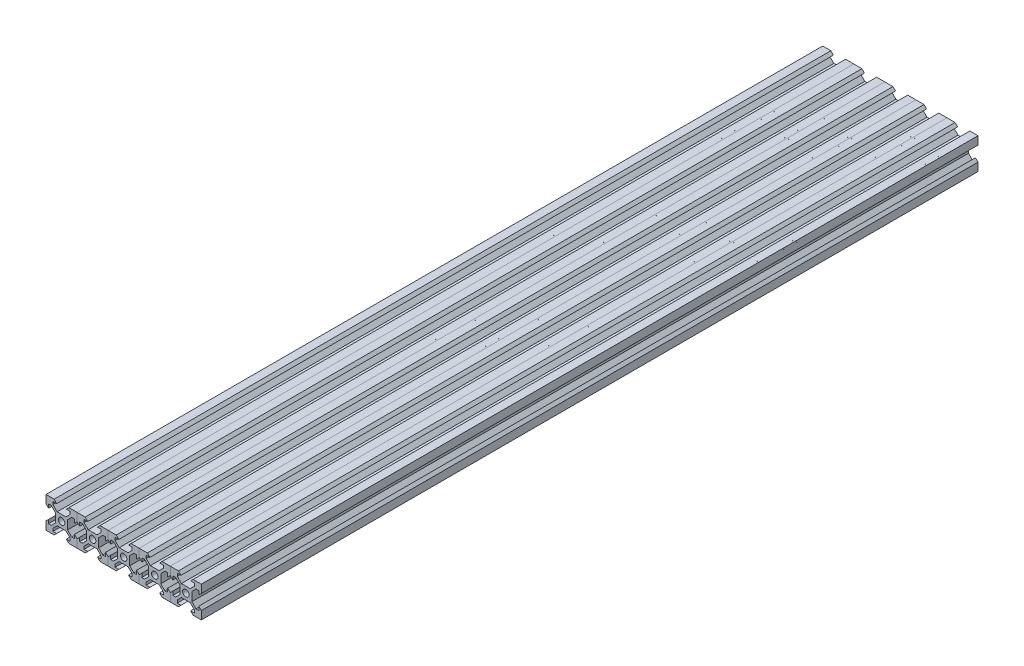
from build123d import *

# Parameters (mm, degrees)
SKETCH1_R           = 2.1
BOSS_EXTRUDE1_DEPTH = 500
MATRIZL1_COUNT      = 5
MATRIZL1_PITCH      = 20


with BuildPart() as part:
    # Sketch1 → Boss-Extrude1 (new body)
    with BuildSketch(Plane.XY):
        Polygon((2.834320347, 3.893970342), (5.5, 6.558849663), (5.5, 8.349069506), (3.1, 8.349069506), (4.75, 9.998574117), (10, 9.998574117), (10, 4.746997406), (8.35, 3.097492795), (8.350720674, 5.497492687), (6.560500912, 5.498030255), (3.894821259, 2.833150935), (3.894821259, -2.833150935), (6.560500912, -5.498030255), (8.350720674, -5.497492687), (8.35, -3.097492795), (10, -4.746997406), (10, -9.998574117), (4.75, -9.998574117), (3.1, -8.349069506), (5.5, -8.349069506), (5.5, -6.558849663), (2.834320347, -3.893970342), (-2.834320347, -3.893970342), (-5.5, -6.558849663), (-5.5, -8.349069506), (-3.1, -8.349069506), (-4.75, -9.998574117), (-10, -9.998574117), (-10, -4.746997406), (-8.35, -3.097492795), (-8.350720674, -5.497492687), (-6.560500912, -5.498030255), (-3.894821259, -2.833150935), (-3.894821259, 2.833150935), (-6.560500912, 5.498030255), (-8.350720674, 5.497492687), (-8.35, 3.097492795), (-10, 4.746997406), (-10, 9.998574117), (-4.75, 9.998574117), (-3.1, 8.349069506), (-5.5, 8.349069506), (-5.5, 6.558849663), (-2.834320347, 3.893970342), align=None)
        Circle(SKETCH1_R, mode=Mode.SUBTRACT)
    extrude(amount=BOSS_EXTRUDE1_DEPTH)


with BuildPart() as matrizl1_1:
    # MatrizL1: pattern copy
    add(part.part.moved(Location(Vector(1, 0, 0) * (1 * MATRIZL1_PITCH))))


with BuildPart() as matrizl1_2:
    # MatrizL1: pattern copy
    add(part.part.moved(Location(Vector(1, 0, 0) * (2 * MATRIZL1_PITCH))))


with BuildPart() as matrizl1_3:
    # MatrizL1: pattern copy
    add(part.part.moved(Location(Vector(1, 0, 0) * (3 * MATRIZL1_PITCH))))


with BuildPart() as matrizl1_4:
    # MatrizL1: pattern copy
    add(part.part.moved(Location(Vector(1, 0, 0) * (4 * MATRIZL1_PITCH))))


solid = Compound([part.part, matrizl1_1.part, matrizl1_2.part, matrizl1_3.part, matrizl1_4.part])
